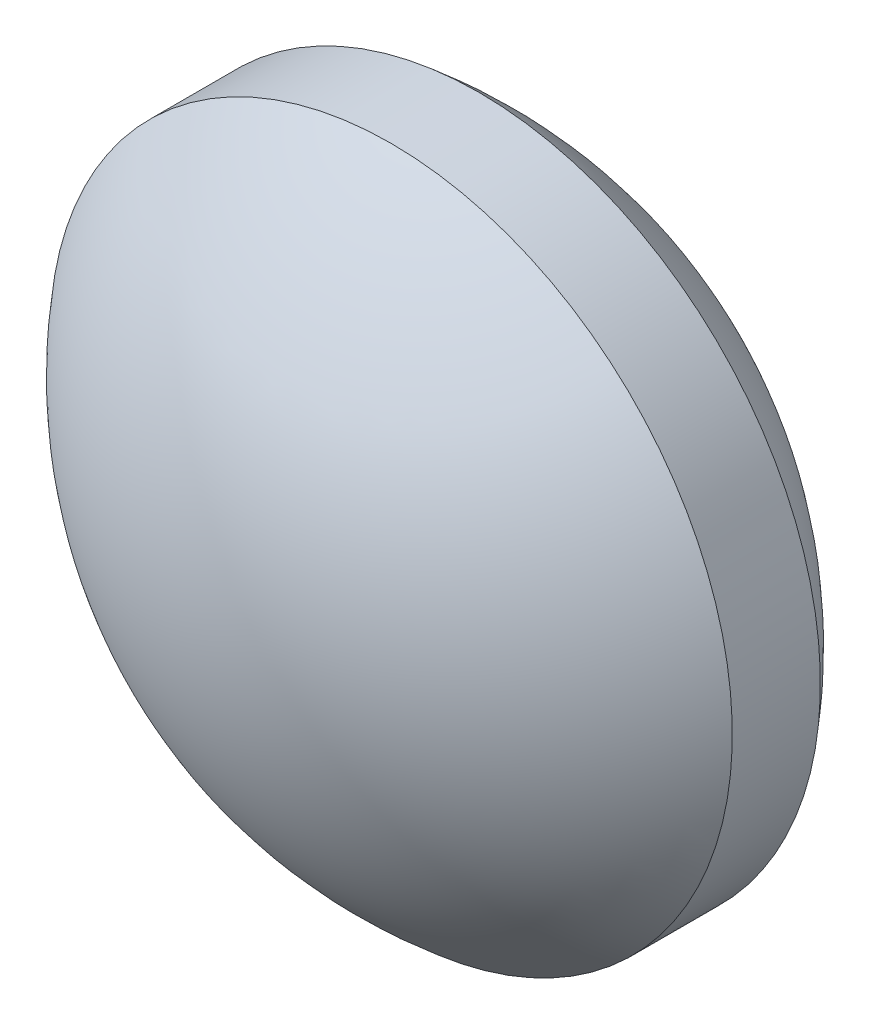
from build123d import *


with BuildPart() as part:
    # Sketch3 → Revolve1 (revolve)
    with BuildSketch(Plane(origin=(0, 0, 0), x_dir=(0, 0, -1), z_dir=(1, 0, 0))):
        with BuildLine():
            Line((0, 3.875), (0, 0))
            Line((0, 0), (2.340193835, 0))
            ThreePointArc((2.340193835, 0), (1.856776106, 2.144874026), (0.5, 3.875))
            Line((0.5, 3.875), (0, 3.875))
        make_face()
        with BuildLine():
            ThreePointArc((-0.5, 3.875), (-1.856776106, 2.144874026), (-2.340193835, 0))
            Line((-2.340193835, 0), (0, 0))
            Line((0, 0), (0, 3.875))
            Line((0, 3.875), (-0.5, 3.875))
        make_face()
    revolve(axis=Axis((0, 0, 0), (0, 0, 1)))


solid = part.part
